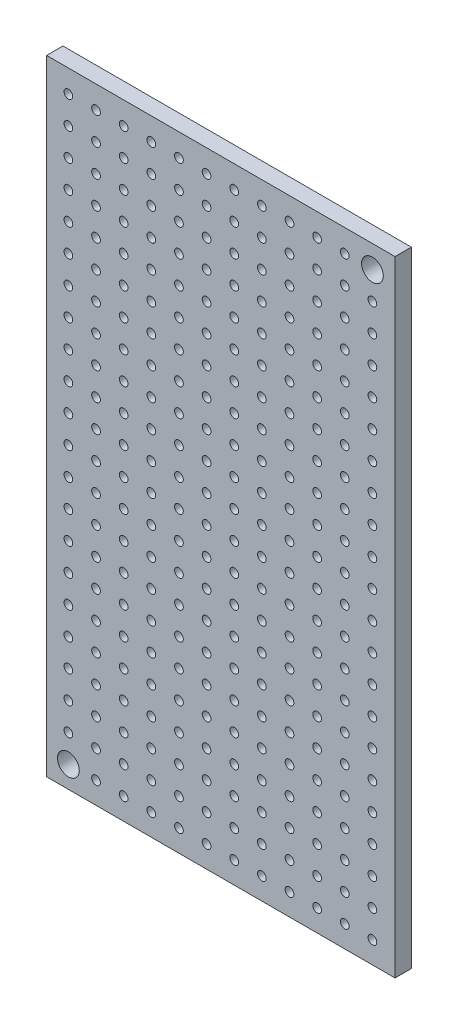
from build123d import *

# Parameters (mm, degrees)
SKETCH1_W           = 32.02
SKETCH1_H           = 57.42
SKETCH1_R           = 0.4
BOSS_EXTRUDE1_DEPTH = 1.5
SKETCH2_R           = 1
CUT_EXTRUDE1_DEPTH  = 5


with BuildPart() as part:
    # Sketch1 → Boss-Extrude1 (new body)
    with BuildSketch(Plane.XY):
        with Locations((16.01, 28.71)):
            Rectangle(SKETCH1_W, SKETCH1_H)
        with Locations((2, 2)):
            Circle(SKETCH1_R, mode=Mode.SUBTRACT)
        with Locations((4.54, 2)):
            Circle(SKETCH1_R, mode=Mode.SUBTRACT)
        with Locations((7.08, 2)):
            Circle(SKETCH1_R, mode=Mode.SUBTRACT)
        with Locations((9.62, 2)):
            Circle(SKETCH1_R, mode=Mode.SUBTRACT)
        with Locations((12.16, 2)):
            Circle(SKETCH1_R, mode=Mode.SUBTRACT)
        with Locations((14.7, 2)):
            Circle(SKETCH1_R, mode=Mode.SUBTRACT)
        with Locations((17.24, 2)):
            Circle(SKETCH1_R, mode=Mode.SUBTRACT)
        with Locations((19.78, 2)):
            Circle(SKETCH1_R, mode=Mode.SUBTRACT)
        with Locations((22.32, 2)):
            Circle(SKETCH1_R, mode=Mode.SUBTRACT)
        with Locations((24.86, 2)):
            Circle(SKETCH1_R, mode=Mode.SUBTRACT)
        with Locations((27.4, 2)):
            Circle(SKETCH1_R, mode=Mode.SUBTRACT)
        with Locations((29.94, 2)):
            Circle(SKETCH1_R, mode=Mode.SUBTRACT)
        with Locations((2, 4.54)):
            Circle(SKETCH1_R, mode=Mode.SUBTRACT)
        with Locations((4.54, 4.54)):
            Circle(SKETCH1_R, mode=Mode.SUBTRACT)
        with Locations((7.08, 4.54)):
            Circle(SKETCH1_R, mode=Mode.SUBTRACT)
        with Locations((9.62, 4.54)):
            Circle(SKETCH1_R, mode=Mode.SUBTRACT)
        with Locations((12.16, 4.54)):
            Circle(SKETCH1_R, mode=Mode.SUBTRACT)
        with Locations((14.7, 4.54)):
            Circle(SKETCH1_R, mode=Mode.SUBTRACT)
        with Locations((17.24, 4.54)):
            Circle(SKETCH1_R, mode=Mode.SUBTRACT)
        with Locations((19.78, 4.54)):
            Circle(SKETCH1_R, mode=Mode.SUBTRACT)
        with Locations((22.32, 4.54)):
            Circle(SKETCH1_R, mode=Mode.SUBTRACT)
        with Locations((24.86, 4.54)):
            Circle(SKETCH1_R, mode=Mode.SUBTRACT)
        with Locations((27.4, 4.54)):
            Circle(SKETCH1_R, mode=Mode.SUBTRACT)
        with Locations((29.94, 4.54)):
            Circle(SKETCH1_R, mode=Mode.SUBTRACT)
        with Locations((2, 7.08)):
            Circle(SKETCH1_R, mode=Mode.SUBTRACT)
        with Locations((4.54, 7.08)):
            Circle(SKETCH1_R, mode=Mode.SUBTRACT)
        with Locations((7.08, 7.08)):
            Circle(SKETCH1_R, mode=Mode.SUBTRACT)
        with Locations((9.62, 7.08)):
            Circle(SKETCH1_R, mode=Mode.SUBTRACT)
        with Locations((12.16, 7.08)):
            Circle(SKETCH1_R, mode=Mode.SUBTRACT)
        with Locations((14.7, 7.08)):
            Circle(SKETCH1_R, mode=Mode.SUBTRACT)
        with Locations((17.24, 7.08)):
            Circle(SKETCH1_R, mode=Mode.SUBTRACT)
        with Locations((19.78, 7.08)):
            Circle(SKETCH1_R, mode=Mode.SUBTRACT)
        with Locations((22.32, 7.08)):
            Circle(SKETCH1_R, mode=Mode.SUBTRACT)
        with Locations((24.86, 7.08)):
            Circle(SKETCH1_R, mode=Mode.SUBTRACT)
        with Locations((27.4, 7.08)):
            Circle(SKETCH1_R, mode=Mode.SUBTRACT)
        with Locations((29.94, 7.08)):
            Circle(SKETCH1_R, mode=Mode.SUBTRACT)
        with Locations((2, 9.62)):
            Circle(SKETCH1_R, mode=Mode.SUBTRACT)
        with Locations((4.54, 9.62)):
            Circle(SKETCH1_R, mode=Mode.SUBTRACT)
        with Locations((7.08, 9.62)):
            Circle(SKETCH1_R, mode=Mode.SUBTRACT)
        with Locations((9.62, 9.62)):
            Circle(SKETCH1_R, mode=Mode.SUBTRACT)
        with Locations((12.16, 9.62)):
            Circle(SKETCH1_R, mode=Mode.SUBTRACT)
        with Locations((14.7, 9.62)):
            Circle(SKETCH1_R, mode=Mode.SUBTRACT)
        with Locations((17.24, 9.62)):
            Circle(SKETCH1_R, mode=Mode.SUBTRACT)
        with Locations((19.78, 9.62)):
            Circle(SKETCH1_R, mode=Mode.SUBTRACT)
        with Locations((22.32, 9.62)):
            Circle(SKETCH1_R, mode=Mode.SUBTRACT)
        with Locations((24.86, 9.62)):
            Circle(SKETCH1_R, mode=Mode.SUBTRACT)
        with Locations((27.4, 9.62)):
            Circle(SKETCH1_R, mode=Mode.SUBTRACT)
        with Locations((29.94, 9.62)):
            Circle(SKETCH1_R, mode=Mode.SUBTRACT)
        with Locations((2, 12.16)):
            Circle(SKETCH1_R, mode=Mode.SUBTRACT)
        with Locations((4.54, 12.16)):
            Circle(SKETCH1_R, mode=Mode.SUBTRACT)
        with Locations((7.08, 12.16)):
            Circle(SKETCH1_R, mode=Mode.SUBTRACT)
        with Locations((9.62, 12.16)):
            Circle(SKETCH1_R, mode=Mode.SUBTRACT)
        with Locations((12.16, 12.16)):
            Circle(SKETCH1_R, mode=Mode.SUBTRACT)
        with Locations((14.7, 12.16)):
            Circle(SKETCH1_R, mode=Mode.SUBTRACT)
        with Locations((17.24, 12.16)):
            Circle(SKETCH1_R, mode=Mode.SUBTRACT)
        with Locations((19.78, 12.16)):
            Circle(SKETCH1_R, mode=Mode.SUBTRACT)
        with Locations((22.32, 12.16)):
            Circle(SKETCH1_R, mode=Mode.SUBTRACT)
        with Locations((24.86, 12.16)):
            Circle(SKETCH1_R, mode=Mode.SUBTRACT)
        with Locations((27.4, 12.16)):
            Circle(SKETCH1_R, mode=Mode.SUBTRACT)
        with Locations((29.94, 12.16)):
            Circle(SKETCH1_R, mode=Mode.SUBTRACT)
        with Locations((2, 14.7)):
            Circle(SKETCH1_R, mode=Mode.SUBTRACT)
        with Locations((4.54, 14.7)):
            Circle(SKETCH1_R, mode=Mode.SUBTRACT)
        with Locations((7.08, 14.7)):
            Circle(SKETCH1_R, mode=Mode.SUBTRACT)
        with Locations((9.62, 14.7)):
            Circle(SKETCH1_R, mode=Mode.SUBTRACT)
        with Locations((12.16, 14.7)):
            Circle(SKETCH1_R, mode=Mode.SUBTRACT)
        with Locations((14.7, 14.7)):
            Circle(SKETCH1_R, mode=Mode.SUBTRACT)
        with Locations((17.24, 14.7)):
            Circle(SKETCH1_R, mode=Mode.SUBTRACT)
        with Locations((19.78, 14.7)):
            Circle(SKETCH1_R, mode=Mode.SUBTRACT)
        with Locations((22.32, 14.7)):
            Circle(SKETCH1_R, mode=Mode.SUBTRACT)
        with Locations((24.86, 14.7)):
            Circle(SKETCH1_R, mode=Mode.SUBTRACT)
        with Locations((27.4, 14.7)):
            Circle(SKETCH1_R, mode=Mode.SUBTRACT)
        with Locations((29.94, 14.7)):
            Circle(SKETCH1_R, mode=Mode.SUBTRACT)
        with Locations((2, 17.24)):
            Circle(SKETCH1_R, mode=Mode.SUBTRACT)
        with Locations((4.54, 17.24)):
            Circle(SKETCH1_R, mode=Mode.SUBTRACT)
        with Locations((7.08, 17.24)):
            Circle(SKETCH1_R, mode=Mode.SUBTRACT)
        with Locations((9.62, 17.24)):
            Circle(SKETCH1_R, mode=Mode.SUBTRACT)
        with Locations((12.16, 17.24)):
            Circle(SKETCH1_R, mode=Mode.SUBTRACT)
        with Locations((14.7, 17.24)):
            Circle(SKETCH1_R, mode=Mode.SUBTRACT)
        with Locations((17.24, 17.24)):
            Circle(SKETCH1_R, mode=Mode.SUBTRACT)
        with Locations((19.78, 17.24)):
            Circle(SKETCH1_R, mode=Mode.SUBTRACT)
        with Locations((22.32, 17.24)):
            Circle(SKETCH1_R, mode=Mode.SUBTRACT)
        with Locations((24.86, 17.24)):
            Circle(SKETCH1_R, mode=Mode.SUBTRACT)
        with Locations((27.4, 17.24)):
            Circle(SKETCH1_R, mode=Mode.SUBTRACT)
        with Locations((29.94, 17.24)):
            Circle(SKETCH1_R, mode=Mode.SUBTRACT)
        with Locations((2, 19.78)):
            Circle(SKETCH1_R, mode=Mode.SUBTRACT)
        with Locations((4.54, 19.78)):
            Circle(SKETCH1_R, mode=Mode.SUBTRACT)
        with Locations((7.08, 19.78)):
            Circle(SKETCH1_R, mode=Mode.SUBTRACT)
        with Locations((9.62, 19.78)):
            Circle(SKETCH1_R, mode=Mode.SUBTRACT)
        with Locations((12.16, 19.78)):
            Circle(SKETCH1_R, mode=Mode.SUBTRACT)
        with Locations((14.7, 19.78)):
            Circle(SKETCH1_R, mode=Mode.SUBTRACT)
        with Locations((17.24, 19.78)):
            Circle(SKETCH1_R, mode=Mode.SUBTRACT)
        with Locations((19.78, 19.78)):
            Circle(SKETCH1_R, mode=Mode.SUBTRACT)
        with Locations((22.32, 19.78)):
            Circle(SKETCH1_R, mode=Mode.SUBTRACT)
        with Locations((24.86, 19.78)):
            Circle(SKETCH1_R, mode=Mode.SUBTRACT)
        with Locations((27.4, 19.78)):
            Circle(SKETCH1_R, mode=Mode.SUBTRACT)
        with Locations((29.94, 19.78)):
            Circle(SKETCH1_R, mode=Mode.SUBTRACT)
        with Locations((2, 22.32)):
            Circle(SKETCH1_R, mode=Mode.SUBTRACT)
        with Locations((4.54, 22.32)):
            Circle(SKETCH1_R, mode=Mode.SUBTRACT)
        with Locations((7.08, 22.32)):
            Circle(SKETCH1_R, mode=Mode.SUBTRACT)
        with Locations((9.62, 22.32)):
            Circle(SKETCH1_R, mode=Mode.SUBTRACT)
        with Locations((12.16, 22.32)):
            Circle(SKETCH1_R, mode=Mode.SUBTRACT)
        with Locations((14.7, 22.32)):
            Circle(SKETCH1_R, mode=Mode.SUBTRACT)
        with Locations((17.24, 22.32)):
            Circle(SKETCH1_R, mode=Mode.SUBTRACT)
        with Locations((19.78, 22.32)):
            Circle(SKETCH1_R, mode=Mode.SUBTRACT)
        with Locations((22.32, 22.32)):
            Circle(SKETCH1_R, mode=Mode.SUBTRACT)
        with Locations((24.86, 22.32)):
            Circle(SKETCH1_R, mode=Mode.SUBTRACT)
        with Locations((27.4, 22.32)):
            Circle(SKETCH1_R, mode=Mode.SUBTRACT)
        with Locations((29.94, 22.32)):
            Circle(SKETCH1_R, mode=Mode.SUBTRACT)
        with Locations((2, 24.86)):
            Circle(SKETCH1_R, mode=Mode.SUBTRACT)
        with Locations((4.54, 24.86)):
            Circle(SKETCH1_R, mode=Mode.SUBTRACT)
        with Locations((7.08, 24.86)):
            Circle(SKETCH1_R, mode=Mode.SUBTRACT)
        with Locations((9.62, 24.86)):
            Circle(SKETCH1_R, mode=Mode.SUBTRACT)
        with Locations((12.16, 24.86)):
            Circle(SKETCH1_R, mode=Mode.SUBTRACT)
        with Locations((14.7, 24.86)):
            Circle(SKETCH1_R, mode=Mode.SUBTRACT)
        with Locations((17.24, 24.86)):
            Circle(SKETCH1_R, mode=Mode.SUBTRACT)
        with Locations((19.78, 24.86)):
            Circle(SKETCH1_R, mode=Mode.SUBTRACT)
        with Locations((22.32, 24.86)):
            Circle(SKETCH1_R, mode=Mode.SUBTRACT)
        with Locations((24.86, 24.86)):
            Circle(SKETCH1_R, mode=Mode.SUBTRACT)
        with Locations((27.4, 24.86)):
            Circle(SKETCH1_R, mode=Mode.SUBTRACT)
        with Locations((29.94, 24.86)):
            Circle(SKETCH1_R, mode=Mode.SUBTRACT)
        with Locations((2, 27.4)):
            Circle(SKETCH1_R, mode=Mode.SUBTRACT)
        with Locations((4.54, 27.4)):
            Circle(SKETCH1_R, mode=Mode.SUBTRACT)
        with Locations((7.08, 27.4)):
            Circle(SKETCH1_R, mode=Mode.SUBTRACT)
        with Locations((9.62, 27.4)):
            Circle(SKETCH1_R, mode=Mode.SUBTRACT)
        with Locations((12.16, 27.4)):
            Circle(SKETCH1_R, mode=Mode.SUBTRACT)
        with Locations((14.7, 27.4)):
            Circle(SKETCH1_R, mode=Mode.SUBTRACT)
        with Locations((17.24, 27.4)):
            Circle(SKETCH1_R, mode=Mode.SUBTRACT)
        with Locations((19.78, 27.4)):
            Circle(SKETCH1_R, mode=Mode.SUBTRACT)
        with Locations((22.32, 27.4)):
            Circle(SKETCH1_R, mode=Mode.SUBTRACT)
        with Locations((24.86, 27.4)):
            Circle(SKETCH1_R, mode=Mode.SUBTRACT)
        with Locations((27.4, 27.4)):
            Circle(SKETCH1_R, mode=Mode.SUBTRACT)
        with Locations((29.94, 27.4)):
            Circle(SKETCH1_R, mode=Mode.SUBTRACT)
        with Locations((2, 29.94)):
            Circle(SKETCH1_R, mode=Mode.SUBTRACT)
        with Locations((4.54, 29.94)):
            Circle(SKETCH1_R, mode=Mode.SUBTRACT)
        with Locations((7.08, 29.94)):
            Circle(SKETCH1_R, mode=Mode.SUBTRACT)
        with Locations((9.62, 29.94)):
            Circle(SKETCH1_R, mode=Mode.SUBTRACT)
        with Locations((12.16, 29.94)):
            Circle(SKETCH1_R, mode=Mode.SUBTRACT)
        with Locations((14.7, 29.94)):
            Circle(SKETCH1_R, mode=Mode.SUBTRACT)
        with Locations((17.24, 29.94)):
            Circle(SKETCH1_R, mode=Mode.SUBTRACT)
        with Locations((19.78, 29.94)):
            Circle(SKETCH1_R, mode=Mode.SUBTRACT)
        with Locations((22.32, 29.94)):
            Circle(SKETCH1_R, mode=Mode.SUBTRACT)
        with Locations((24.86, 29.94)):
            Circle(SKETCH1_R, mode=Mode.SUBTRACT)
        with Locations((27.4, 29.94)):
            Circle(SKETCH1_R, mode=Mode.SUBTRACT)
        with Locations((29.94, 29.94)):
            Circle(SKETCH1_R, mode=Mode.SUBTRACT)
        with Locations((2, 32.48)):
            Circle(SKETCH1_R, mode=Mode.SUBTRACT)
        with Locations((4.54, 32.48)):
            Circle(SKETCH1_R, mode=Mode.SUBTRACT)
        with Locations((7.08, 32.48)):
            Circle(SKETCH1_R, mode=Mode.SUBTRACT)
        with Locations((9.62, 32.48)):
            Circle(SKETCH1_R, mode=Mode.SUBTRACT)
        with Locations((12.16, 32.48)):
            Circle(SKETCH1_R, mode=Mode.SUBTRACT)
        with Locations((14.7, 32.48)):
            Circle(SKETCH1_R, mode=Mode.SUBTRACT)
        with Locations((17.24, 32.48)):
            Circle(SKETCH1_R, mode=Mode.SUBTRACT)
        with Locations((19.78, 32.48)):
            Circle(SKETCH1_R, mode=Mode.SUBTRACT)
        with Locations((22.32, 32.48)):
            Circle(SKETCH1_R, mode=Mode.SUBTRACT)
        with Locations((24.86, 32.48)):
            Circle(SKETCH1_R, mode=Mode.SUBTRACT)
        with Locations((27.4, 32.48)):
            Circle(SKETCH1_R, mode=Mode.SUBTRACT)
        with Locations((29.94, 32.48)):
            Circle(SKETCH1_R, mode=Mode.SUBTRACT)
        with Locations((2, 35.02)):
            Circle(SKETCH1_R, mode=Mode.SUBTRACT)
        with Locations((4.54, 35.02)):
            Circle(SKETCH1_R, mode=Mode.SUBTRACT)
        with Locations((7.08, 35.02)):
            Circle(SKETCH1_R, mode=Mode.SUBTRACT)
        with Locations((9.62, 35.02)):
            Circle(SKETCH1_R, mode=Mode.SUBTRACT)
        with Locations((12.16, 35.02)):
            Circle(SKETCH1_R, mode=Mode.SUBTRACT)
        with Locations((14.7, 35.02)):
            Circle(SKETCH1_R, mode=Mode.SUBTRACT)
        with Locations((17.24, 35.02)):
            Circle(SKETCH1_R, mode=Mode.SUBTRACT)
        with Locations((19.78, 35.02)):
            Circle(SKETCH1_R, mode=Mode.SUBTRACT)
        with Locations((22.32, 35.02)):
            Circle(SKETCH1_R, mode=Mode.SUBTRACT)
        with Locations((24.86, 35.02)):
            Circle(SKETCH1_R, mode=Mode.SUBTRACT)
        with Locations((27.4, 35.02)):
            Circle(SKETCH1_R, mode=Mode.SUBTRACT)
        with Locations((29.94, 35.02)):
            Circle(SKETCH1_R, mode=Mode.SUBTRACT)
        with Locations((2, 37.56)):
            Circle(SKETCH1_R, mode=Mode.SUBTRACT)
        with Locations((4.54, 37.56)):
            Circle(SKETCH1_R, mode=Mode.SUBTRACT)
        with Locations((7.08, 37.56)):
            Circle(SKETCH1_R, mode=Mode.SUBTRACT)
        with Locations((9.62, 37.56)):
            Circle(SKETCH1_R, mode=Mode.SUBTRACT)
        with Locations((12.16, 37.56)):
            Circle(SKETCH1_R, mode=Mode.SUBTRACT)
        with Locations((14.7, 37.56)):
            Circle(SKETCH1_R, mode=Mode.SUBTRACT)
        with Locations((17.24, 37.56)):
            Circle(SKETCH1_R, mode=Mode.SUBTRACT)
        with Locations((19.78, 37.56)):
            Circle(SKETCH1_R, mode=Mode.SUBTRACT)
        with Locations((22.32, 37.56)):
            Circle(SKETCH1_R, mode=Mode.SUBTRACT)
        with Locations((24.86, 37.56)):
            Circle(SKETCH1_R, mode=Mode.SUBTRACT)
        with Locations((27.4, 37.56)):
            Circle(SKETCH1_R, mode=Mode.SUBTRACT)
        with Locations((29.94, 37.56)):
            Circle(SKETCH1_R, mode=Mode.SUBTRACT)
        with Locations((2, 40.1)):
            Circle(SKETCH1_R, mode=Mode.SUBTRACT)
        with Locations((4.54, 40.1)):
            Circle(SKETCH1_R, mode=Mode.SUBTRACT)
        with Locations((7.08, 40.1)):
            Circle(SKETCH1_R, mode=Mode.SUBTRACT)
        with Locations((9.62, 40.1)):
            Circle(SKETCH1_R, mode=Mode.SUBTRACT)
        with Locations((12.16, 40.1)):
            Circle(SKETCH1_R, mode=Mode.SUBTRACT)
        with Locations((14.7, 40.1)):
            Circle(SKETCH1_R, mode=Mode.SUBTRACT)
        with Locations((17.24, 40.1)):
            Circle(SKETCH1_R, mode=Mode.SUBTRACT)
        with Locations((19.78, 40.1)):
            Circle(SKETCH1_R, mode=Mode.SUBTRACT)
        with Locations((22.32, 40.1)):
            Circle(SKETCH1_R, mode=Mode.SUBTRACT)
        with Locations((24.86, 40.1)):
            Circle(SKETCH1_R, mode=Mode.SUBTRACT)
        with Locations((27.4, 40.1)):
            Circle(SKETCH1_R, mode=Mode.SUBTRACT)
        with Locations((29.94, 40.1)):
            Circle(SKETCH1_R, mode=Mode.SUBTRACT)
        with Locations((2, 42.64)):
            Circle(SKETCH1_R, mode=Mode.SUBTRACT)
        with Locations((4.54, 42.64)):
            Circle(SKETCH1_R, mode=Mode.SUBTRACT)
        with Locations((7.08, 42.64)):
            Circle(SKETCH1_R, mode=Mode.SUBTRACT)
        with Locations((9.62, 42.64)):
            Circle(SKETCH1_R, mode=Mode.SUBTRACT)
        with Locations((12.16, 42.64)):
            Circle(SKETCH1_R, mode=Mode.SUBTRACT)
        with Locations((14.7, 42.64)):
            Circle(SKETCH1_R, mode=Mode.SUBTRACT)
        with Locations((17.24, 42.64)):
            Circle(SKETCH1_R, mode=Mode.SUBTRACT)
        with Locations((19.78, 42.64)):
            Circle(SKETCH1_R, mode=Mode.SUBTRACT)
        with Locations((22.32, 42.64)):
            Circle(SKETCH1_R, mode=Mode.SUBTRACT)
        with Locations((24.86, 42.64)):
            Circle(SKETCH1_R, mode=Mode.SUBTRACT)
        with Locations((27.4, 42.64)):
            Circle(SKETCH1_R, mode=Mode.SUBTRACT)
        with Locations((29.94, 42.64)):
            Circle(SKETCH1_R, mode=Mode.SUBTRACT)
        with Locations((2, 45.18)):
            Circle(SKETCH1_R, mode=Mode.SUBTRACT)
        with Locations((4.54, 45.18)):
            Circle(SKETCH1_R, mode=Mode.SUBTRACT)
        with Locations((7.08, 45.18)):
            Circle(SKETCH1_R, mode=Mode.SUBTRACT)
        with Locations((9.62, 45.18)):
            Circle(SKETCH1_R, mode=Mode.SUBTRACT)
        with Locations((12.16, 45.18)):
            Circle(SKETCH1_R, mode=Mode.SUBTRACT)
        with Locations((14.7, 45.18)):
            Circle(SKETCH1_R, mode=Mode.SUBTRACT)
        with Locations((17.24, 45.18)):
            Circle(SKETCH1_R, mode=Mode.SUBTRACT)
        with Locations((19.78, 45.18)):
            Circle(SKETCH1_R, mode=Mode.SUBTRACT)
        with Locations((22.32, 45.18)):
            Circle(SKETCH1_R, mode=Mode.SUBTRACT)
        with Locations((24.86, 45.18)):
            Circle(SKETCH1_R, mode=Mode.SUBTRACT)
        with Locations((27.4, 45.18)):
            Circle(SKETCH1_R, mode=Mode.SUBTRACT)
        with Locations((29.94, 45.18)):
            Circle(SKETCH1_R, mode=Mode.SUBTRACT)
        with Locations((2, 47.72)):
            Circle(SKETCH1_R, mode=Mode.SUBTRACT)
        with Locations((4.54, 47.72)):
            Circle(SKETCH1_R, mode=Mode.SUBTRACT)
        with Locations((7.08, 47.72)):
            Circle(SKETCH1_R, mode=Mode.SUBTRACT)
        with Locations((9.62, 47.72)):
            Circle(SKETCH1_R, mode=Mode.SUBTRACT)
        with Locations((12.16, 47.72)):
            Circle(SKETCH1_R, mode=Mode.SUBTRACT)
        with Locations((14.7, 47.72)):
            Circle(SKETCH1_R, mode=Mode.SUBTRACT)
        with Locations((17.24, 47.72)):
            Circle(SKETCH1_R, mode=Mode.SUBTRACT)
        with Locations((19.78, 47.72)):
            Circle(SKETCH1_R, mode=Mode.SUBTRACT)
        with Locations((22.32, 47.72)):
            Circle(SKETCH1_R, mode=Mode.SUBTRACT)
        with Locations((24.86, 47.72)):
            Circle(SKETCH1_R, mode=Mode.SUBTRACT)
        with Locations((27.4, 47.72)):
            Circle(SKETCH1_R, mode=Mode.SUBTRACT)
        with Locations((29.94, 47.72)):
            Circle(SKETCH1_R, mode=Mode.SUBTRACT)
        with Locations((2, 50.26)):
            Circle(SKETCH1_R, mode=Mode.SUBTRACT)
        with Locations((4.54, 50.26)):
            Circle(SKETCH1_R, mode=Mode.SUBTRACT)
        with Locations((7.08, 50.26)):
            Circle(SKETCH1_R, mode=Mode.SUBTRACT)
        with Locations((9.62, 50.26)):
            Circle(SKETCH1_R, mode=Mode.SUBTRACT)
        with Locations((12.16, 50.26)):
            Circle(SKETCH1_R, mode=Mode.SUBTRACT)
        with Locations((14.7, 50.26)):
            Circle(SKETCH1_R, mode=Mode.SUBTRACT)
        with Locations((17.24, 50.26)):
            Circle(SKETCH1_R, mode=Mode.SUBTRACT)
        with Locations((19.78, 50.26)):
            Circle(SKETCH1_R, mode=Mode.SUBTRACT)
        with Locations((22.32, 50.26)):
            Circle(SKETCH1_R, mode=Mode.SUBTRACT)
        with Locations((24.86, 50.26)):
            Circle(SKETCH1_R, mode=Mode.SUBTRACT)
        with Locations((27.4, 50.26)):
            Circle(SKETCH1_R, mode=Mode.SUBTRACT)
        with Locations((29.94, 50.26)):
            Circle(SKETCH1_R, mode=Mode.SUBTRACT)
        with Locations((2, 52.8)):
            Circle(SKETCH1_R, mode=Mode.SUBTRACT)
        with Locations((4.54, 52.8)):
            Circle(SKETCH1_R, mode=Mode.SUBTRACT)
        with Locations((7.08, 52.8)):
            Circle(SKETCH1_R, mode=Mode.SUBTRACT)
        with Locations((9.62, 52.8)):
            Circle(SKETCH1_R, mode=Mode.SUBTRACT)
        with Locations((12.16, 52.8)):
            Circle(SKETCH1_R, mode=Mode.SUBTRACT)
        with Locations((14.7, 52.8)):
            Circle(SKETCH1_R, mode=Mode.SUBTRACT)
        with Locations((17.24, 52.8)):
            Circle(SKETCH1_R, mode=Mode.SUBTRACT)
        with Locations((19.78, 52.8)):
            Circle(SKETCH1_R, mode=Mode.SUBTRACT)
        with Locations((22.32, 52.8)):
            Circle(SKETCH1_R, mode=Mode.SUBTRACT)
        with Locations((24.86, 52.8)):
            Circle(SKETCH1_R, mode=Mode.SUBTRACT)
        with Locations((27.4, 52.8)):
            Circle(SKETCH1_R, mode=Mode.SUBTRACT)
        with Locations((29.94, 52.8)):
            Circle(SKETCH1_R, mode=Mode.SUBTRACT)
        with Locations((2, 55.34)):
            Circle(SKETCH1_R, mode=Mode.SUBTRACT)
        with Locations((4.54, 55.34)):
            Circle(SKETCH1_R, mode=Mode.SUBTRACT)
        with Locations((7.08, 55.34)):
            Circle(SKETCH1_R, mode=Mode.SUBTRACT)
        with Locations((9.62, 55.34)):
            Circle(SKETCH1_R, mode=Mode.SUBTRACT)
        with Locations((12.16, 55.34)):
            Circle(SKETCH1_R, mode=Mode.SUBTRACT)
        with Locations((14.7, 55.34)):
            Circle(SKETCH1_R, mode=Mode.SUBTRACT)
        with Locations((17.24, 55.34)):
            Circle(SKETCH1_R, mode=Mode.SUBTRACT)
        with Locations((19.78, 55.34)):
            Circle(SKETCH1_R, mode=Mode.SUBTRACT)
        with Locations((22.32, 55.34)):
            Circle(SKETCH1_R, mode=Mode.SUBTRACT)
        with Locations((24.86, 55.34)):
            Circle(SKETCH1_R, mode=Mode.SUBTRACT)
        with Locations((27.4, 55.34)):
            Circle(SKETCH1_R, mode=Mode.SUBTRACT)
        with Locations((29.94, 55.34)):
            Circle(SKETCH1_R, mode=Mode.SUBTRACT)
    extrude(amount=BOSS_EXTRUDE1_DEPTH)

    # Sketch2 → Cut-Extrude1 (cut)
    with BuildSketch(Plane.XY.offset(1.5)):
        with Locations((2, 2)):
            Circle(SKETCH2_R)
        with Locations((29.94, 55.34)):
            Circle(SKETCH2_R)
    extrude(amount=-CUT_EXTRUDE1_DEPTH, mode=Mode.SUBTRACT)


solid = part.part
